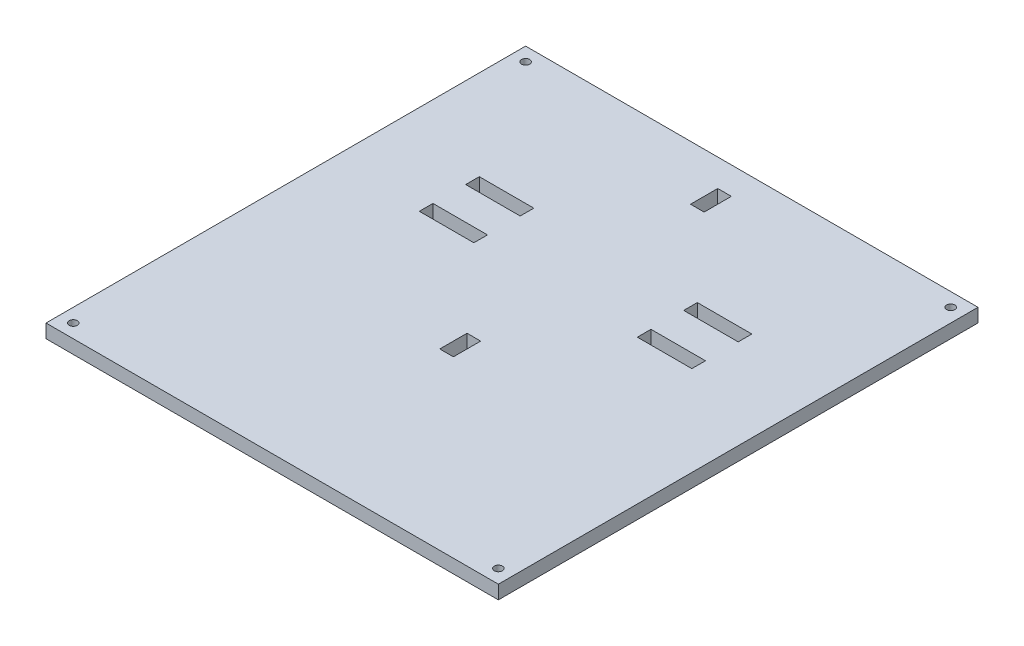
from build123d import *

# Parameters (mm, degrees)
SKETCH_1_R      = 1.5
SKETCH_1_W      = 5
SKETCH_1_H      = 10
SKETCH_1_W_2    = 20
SKETCH_1_H_2    = 5
EXTRUDE_1_DEPTH = 5


with BuildPart() as part:
    # 草图1 → 凸台-拉伸1 (new body)
    with BuildSketch(Plane(origin=(0, 0, 0), x_dir=(1, 0, 0), z_dir=(0, 1, 0))):
        Polygon((0, 0), (0, 116), (0, 130.522242689), (166, 130.522242689), (166, 116), (166, 0), (166, -45.477757311), (0, -45.477757311), align=None)
        with Locations(Location((5, 125.522242689, 0), (0, 0, 270))):
            Circle(SKETCH_1_R, mode=Mode.SUBTRACT)
        with Locations(Location((161, 125.522242689, 0), (0, 0, 270))):
            Circle(SKETCH_1_R, mode=Mode.SUBTRACT)
        with Locations(Location((5, -40.477757311, 0), (0, 0, 270))):
            Circle(SKETCH_1_R, mode=Mode.SUBTRACT)
        with Locations(Location((161, -40.477757311, 0), (0, 0, 270))):
            Circle(SKETCH_1_R, mode=Mode.SUBTRACT)
        with Locations((83, 115.522242689)):
            Rectangle(SKETCH_1_W, SKETCH_1_H, mode=Mode.SUBTRACT)
        with Locations((43, 78.022242689)):
            Rectangle(SKETCH_1_W_2, SKETCH_1_H_2, mode=Mode.SUBTRACT)
        with Locations((43, 61.022242689)):
            Rectangle(SKETCH_1_W_2, SKETCH_1_H_2, mode=Mode.SUBTRACT)
        with Locations((123, 78.022242689)):
            Rectangle(SKETCH_1_W_2, SKETCH_1_H_2, mode=Mode.SUBTRACT)
        with Locations((123, 61.022242689)):
            Rectangle(SKETCH_1_W_2, SKETCH_1_H_2, mode=Mode.SUBTRACT)
        with Locations((83, 23.522242689)):
            Rectangle(SKETCH_1_W, SKETCH_1_H, mode=Mode.SUBTRACT)
    extrude(amount=EXTRUDE_1_DEPTH)


solid = part.part
